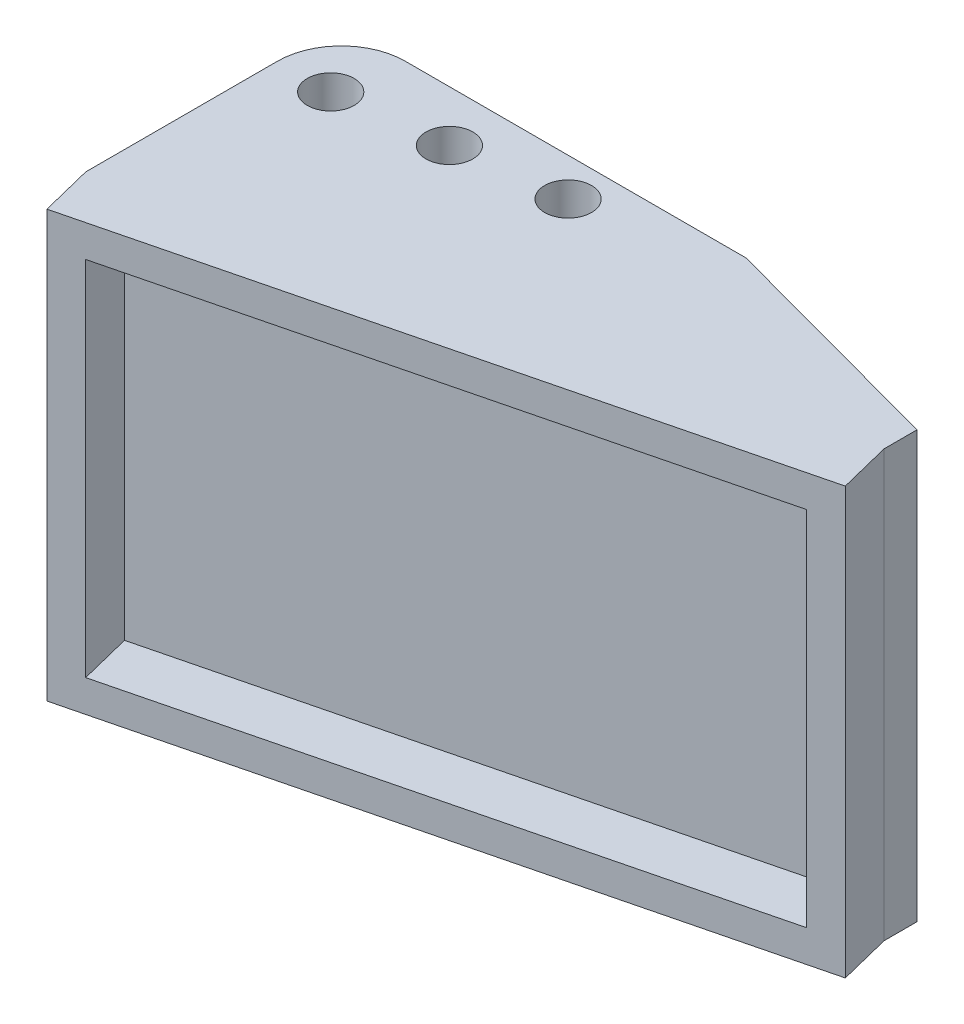
from build123d import *

# Parameters (mm, degrees)
EXTRUDE_1_DEPTH          = 20
SKETCH_2_R               = 1.1
CUT_EXTRUDE_2_DEPTH      = 26.709920264
CUT_EXTRUDE_3_REACH      = 29.731
SKETCH_3_W               = 30
SKETCH_3_H               = 15.1
FILLET_1_R               = 3
SKETCH_6_W               = 30.918408881
SKETCH_6_H               = 20
SKETCH_6_W_2             = 27.918408881
SKETCH_6_H_2             = 17
EXTRUDE_2_DEPTH          = 2.5
CUT_EXTRUDE_4_DEPTH      = 25.9500604
CUT_EXTRUDE_4_DEPTH_BACK = 25.9500604


with BuildPart() as part:
    # 草图1 → 凸台-拉伸1 (new body)
    with BuildSketch(Plane(origin=(0, 0, 0), x_dir=(1, 0, 0), z_dir=(0, 1, 0))):
        Polygon((-15, -6), (15, 1.479840085), (15, 6), (-15, 6), align=None)
    extrude(amount=EXTRUDE_1_DEPTH)

    # 草图2 → 切除-拉伸2 (cut, through all)
    with BuildSketch(Plane(origin=(0, 20, 0), x_dir=(1, 0, 0), z_dir=(0, 1, 0))):
        with Locations(Location((-12.5, 3, 0), (0, 0, 270))):
            Circle(SKETCH_2_R)
        with Locations(Location((-7.537269242, 3.609346717, 0), (0, 0, 270))):
            Circle(SKETCH_2_R)
        with Locations(Location((-2.574538484, 4.218693434, 0), (0, 0, 270))):
            Circle(SKETCH_2_R)
    extrude(amount=-CUT_EXTRUDE_2_DEPTH, mode=Mode.SUBTRACT)

    # 切除-拉伸3: up to this plane
    cut_extrude_3_end = Plane(origin=(0.167638791, 0, 0.672362468), z_dir=(0.24192189559966876, 0, 0.9702957262759963))
    # 草图3 → 切除-拉伸3 (cut, up to the surface)
    with BuildSketch(Plane(origin=(0, 0, -6), x_dir=(-1, 0, 0), z_dir=(0, 0, -1)), mode=Mode.PRIVATE) as cut_extrude_3_sk1:
        with Locations((0, 10)):
            Rectangle(SKETCH_3_W, SKETCH_3_H)
    cut_extrude_3_tool1 = split(extrude(cut_extrude_3_sk1.sketch, amount=-CUT_EXTRUDE_3_REACH, mode=Mode.PRIVATE), bisect_by=cut_extrude_3_end, keep=Keep.BOTH, mode=Mode.PRIVATE)
    add(cut_extrude_3_tool1.solids().sort_by_distance((0, 10, -6))[0], mode=Mode.SUBTRACT)

    # 圆角1
    fillet_1_edges = [part.edges().sort_by_distance(p)[0] for p in [
        (-15, 1.225, -6),
        (-15, 18.775, -6),
    ]]
    fillet(fillet_1_edges, radius=FILLET_1_R)

    # 草图6 → 凸台-拉伸2 (add)
    with BuildSketch(Plane(origin=(0.530521635, 0, 2.127806058), x_dir=(0.9702957262759964, 0, -0.2419218955996687), z_dir=(0.2419218955996687, 0, 0.9702957262759964))):
        with Locations((-0.546762828, 10)):
            Rectangle(SKETCH_6_W, SKETCH_6_H)
        with Locations((-0.546762828, 10)):
            Rectangle(SKETCH_6_W_2, SKETCH_6_H_2, mode=Mode.SUBTRACT)
    extrude(amount=EXTRUDE_2_DEPTH)

    # 草图7 → 切除-拉伸4 (cut, two sides: drawn at the far end of the back side and taken through both)
    with BuildSketch(Plane(origin=(0, 2.45, 0), x_dir=(1, 0, 0), z_dir=(0, 1, 0)).offset(-CUT_EXTRUDE_4_DEPTH_BACK)):
        Polygon((15, 3.025760529), (4, 6), (15, 6), align=None)
    extrude(amount=CUT_EXTRUDE_4_DEPTH + CUT_EXTRUDE_4_DEPTH_BACK, mode=Mode.SUBTRACT)


solid = part.part
